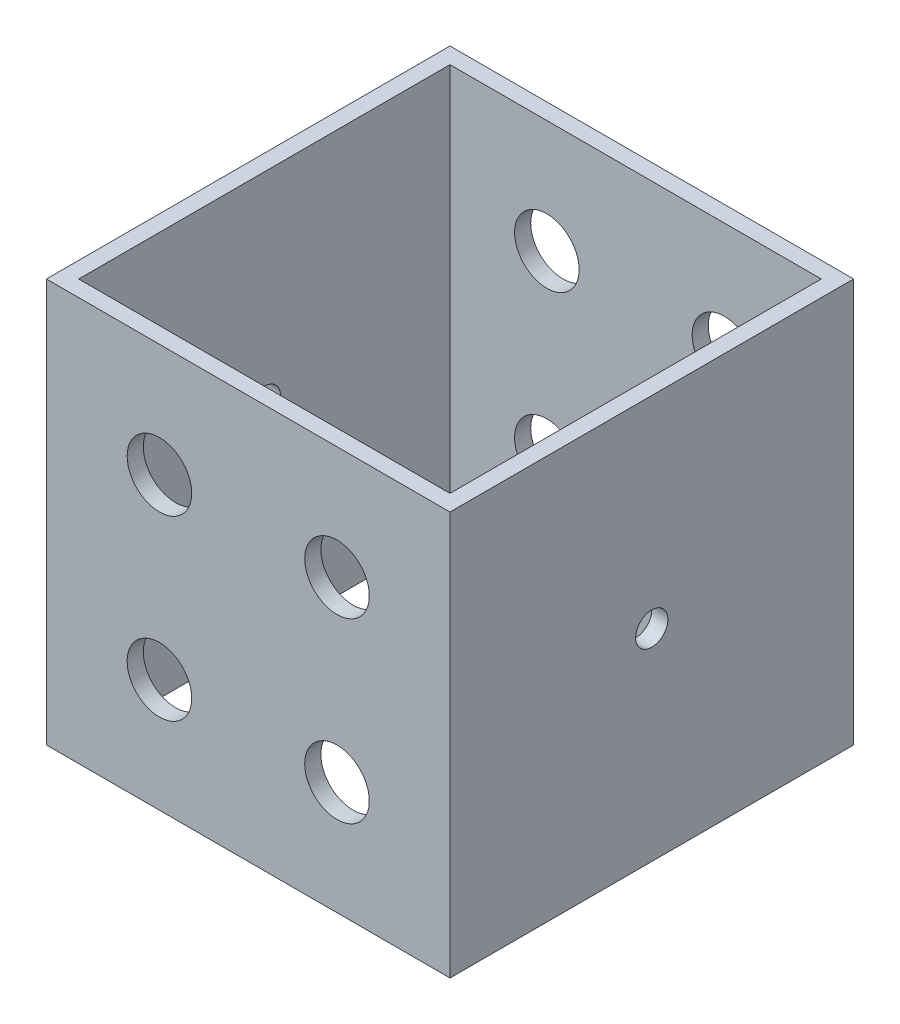
from build123d import *

# Parameters (mm, degrees)
BOSS_EXTRUDE1_DEPTH      = 12.5
BOSS_EXTRUDE1_DEPTH_BACK = 12.5
SKETCH1_W                = 25
SKETCH1_H                = 25
SKETCH1_W_2              = 23
SKETCH1_H_2              = 23
SKETCH2_R                = 2
CUT_EXTRUDE1_DEPTH       = 25
SKETCH3_R                = 1
CUT_EXTRUDE2_DEPTH       = 25


with BuildPart() as part:
    # Sketch1 → Boss-Extrude1 (new, two sides: drawn at the far end of the back side and taken through both)
    with BuildSketch(Plane(origin=(0, 0, 0), x_dir=(1, 0, 0), z_dir=(0, 1, 0)).offset(-BOSS_EXTRUDE1_DEPTH_BACK)):
        Rectangle(SKETCH1_W, SKETCH1_H)
        Rectangle(SKETCH1_W_2, SKETCH1_H_2, mode=Mode.SUBTRACT)
    extrude(amount=BOSS_EXTRUDE1_DEPTH + BOSS_EXTRUDE1_DEPTH_BACK)

    # Sketch2 → Cut-Extrude1 (cut)
    with BuildSketch(Plane(origin=(0, 0, -12.5), x_dir=(-1, 0, 0), z_dir=(0, 0, -1))):
        with Locations((5.5, 5.5)):
            Circle(SKETCH2_R)
        with Locations((5.5, -5.5)):
            Circle(SKETCH2_R)
        with Locations((-5.5, -5.5)):
            Circle(SKETCH2_R)
        with Locations((-5.5, 5.5)):
            Circle(SKETCH2_R)
    extrude(amount=-CUT_EXTRUDE1_DEPTH, mode=Mode.SUBTRACT)

    # Sketch3 → Cut-Extrude2 (cut)
    with BuildSketch(Plane(origin=(12.5, 0, 0), x_dir=(0, 0, -1), z_dir=(1, 0, 0))):
        Circle(SKETCH3_R)
    extrude(amount=-CUT_EXTRUDE2_DEPTH, mode=Mode.SUBTRACT)


solid = part.part
